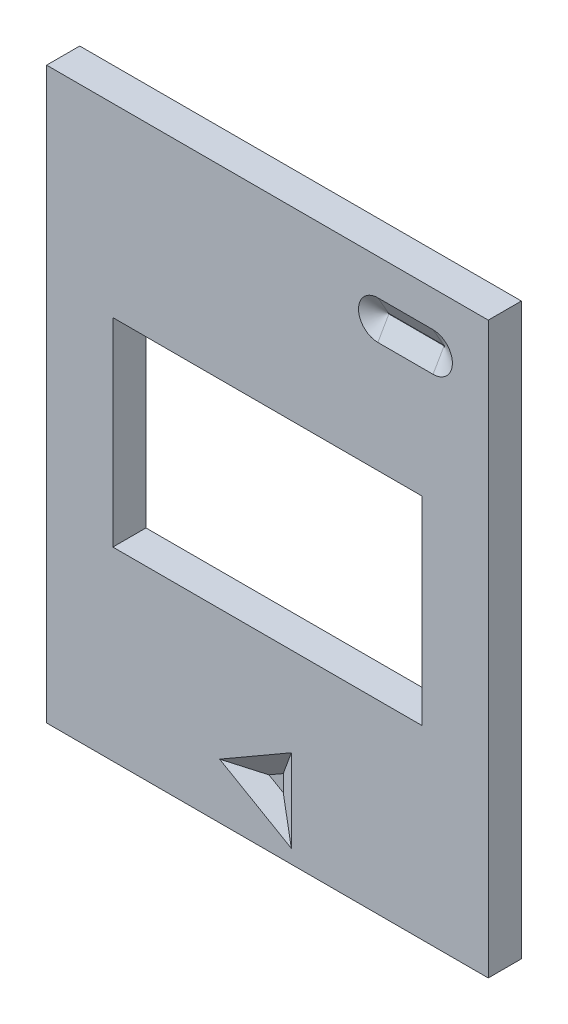
from build123d import *

# Parameters (mm, degrees)
SKETCH1_W           = 40
SKETCH1_H           = 51.6
BOSS_EXTRUDE1_DEPTH = 3
SKETCH2_W           = 28
SKETCH2_H           = 18
CUT_EXTRUDE1_DEPTH  = 66.357172521
CUT_EXTRUDE2_DEPTH  = 1
CUT_EXTRUDE2_DRAFT  = -60
CUT_EXTRUDE3_DEPTH  = 1
CUT_EXTRUDE3_DRAFT  = -60


with BuildPart() as part:
    # Sketch1 → Boss-Extrude1 (new body)
    with BuildSketch(Plane.XY):
        with Locations((20, 25.8)):
            Rectangle(SKETCH1_W, SKETCH1_H)
    extrude(amount=-BOSS_EXTRUDE1_DEPTH)

    # Sketch2 → Cut-Extrude1 (cut, through all)
    with BuildSketch(Plane(origin=(0, 0, -3), x_dir=(-1, 0, 0), z_dir=(0, 0, -1))):
        with Locations((-20, 25.8)):
            Rectangle(SKETCH2_W, SKETCH2_H)
    extrude(amount=-CUT_EXTRUDE1_DEPTH, mode=Mode.SUBTRACT)


with BuildPart() as cut_extrude2_tool:
    # Sketch3 → Cut-Extrude2 (with draft: the straight prism first)
    with BuildSketch(Plane.XY):
        with BuildLine():
            Line((35, 48.35), (30, 48.35))
            ThreePointArc((30, 48.35), (28.25, 46.6), (30, 44.85))
            Line((30, 44.85), (35, 44.85))
            ThreePointArc((35, 44.85), (36.75, 46.6), (35, 48.35))
        make_face()
    extrude(amount=-CUT_EXTRUDE2_DEPTH)
    # Cut-Extrude2: the draft: its side faces are tilted about the plane it starts from
    cut_extrude2_sides = [cut_extrude2_tool.faces().sort_by_distance(p)[0] for p in [
        (32.5, 48.35, -0.5),
        (28.25, 46.6, -0.5),
        (32.5, 44.85, -0.5),
        (36.75, 46.6, -0.5),
    ]]
    draft(cut_extrude2_sides, Plane.XY, CUT_EXTRUDE2_DRAFT)


with BuildPart() as part_1:
    add(part.part)

    # Cut-Extrude2: cut by cut_extrude2_tool
    add(cut_extrude2_tool.part, mode=Mode.SUBTRACT)


with BuildPart() as cut_extrude3_tool:
    # Sketch4 → Cut-Extrude3 (with draft: the straight prism first)
    with BuildSketch(Plane.XY):
        Polygon((15.669872981, 5), (22.165063509, 1.25), (22.165063509, 8.75), align=None)
    extrude(amount=-CUT_EXTRUDE3_DEPTH)
    # Cut-Extrude3: the draft: its side faces are tilted about the plane it starts from
    cut_extrude3_sides = [cut_extrude3_tool.faces().sort_by_distance(p)[0] for p in [
        (18.917468245, 3.125, -0.5),
        (22.165063509, 5, -0.5),
        (18.917468245, 6.875, -0.5),
    ]]
    draft(cut_extrude3_sides, Plane.XY, CUT_EXTRUDE3_DRAFT)


with BuildPart() as part_2:
    add(part_1.part)

    # Cut-Extrude3: cut by cut_extrude3_tool
    add(cut_extrude3_tool.part, mode=Mode.SUBTRACT)


solid = part_2.part
